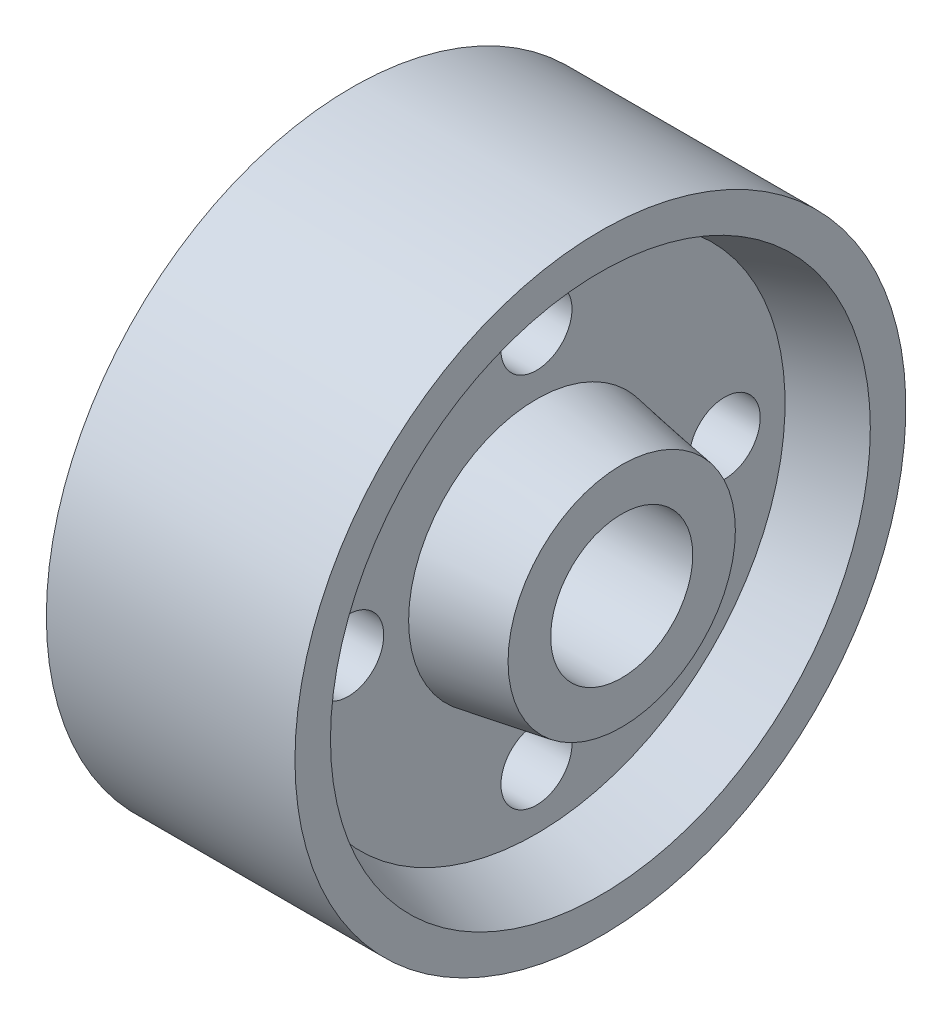
from build123d import *

# Parameters (mm, degrees)
SKETCH4_R          = 5
CUT_EXTRUDE1_DEPTH = 74.341666193
SKETCH5_R          = 10
CUT_EXTRUDE2_DEPTH = 74.341666193


with BuildPart() as part:
    # Sketch3 → Revolve1 (revolve)
    with BuildSketch(Plane(origin=(0, 0, 0), x_dir=(1, 0, 0), z_dir=(0, 1, 0)), mode=Mode.PRIVATE) as revolve1_sk:
        Polygon((0, 0), (0, 16), (12, 18), (12, 35), (3, 38), (3, 43), (38, 43), (38, 38), (29, 35), (29, 18), (41, 16), (41, 0), align=None)
    revolve(revolve1_sk.sketch.rotate(Axis((0, 0, 0), (1, 0, 0)), 180), axis=Axis((0, 0, 0), (1, 0, 0)))

    # Sketch4 → Cut-Extrude1 (cut, through all)
    with BuildSketch(Plane(origin=(41, 0, 0), x_dir=(0, 0, -1), z_dir=(1, 0, 0))):
        with Locations((0, 26.5)):
            Circle(SKETCH4_R)
        with Locations((26.5, 0)):
            Circle(SKETCH4_R)
        with Locations((0, -26.5)):
            Circle(SKETCH4_R)
        with Locations((-26.5, 0)):
            Circle(SKETCH4_R)
    extrude(amount=-CUT_EXTRUDE1_DEPTH, mode=Mode.SUBTRACT)

    # Sketch5 → Cut-Extrude2 (cut, through all)
    with BuildSketch(Plane(origin=(41, 0, 0), x_dir=(0, 0, -1), z_dir=(1, 0, 0))):
        Circle(SKETCH5_R)
    extrude(amount=-CUT_EXTRUDE2_DEPTH, mode=Mode.SUBTRACT)


solid = part.part
